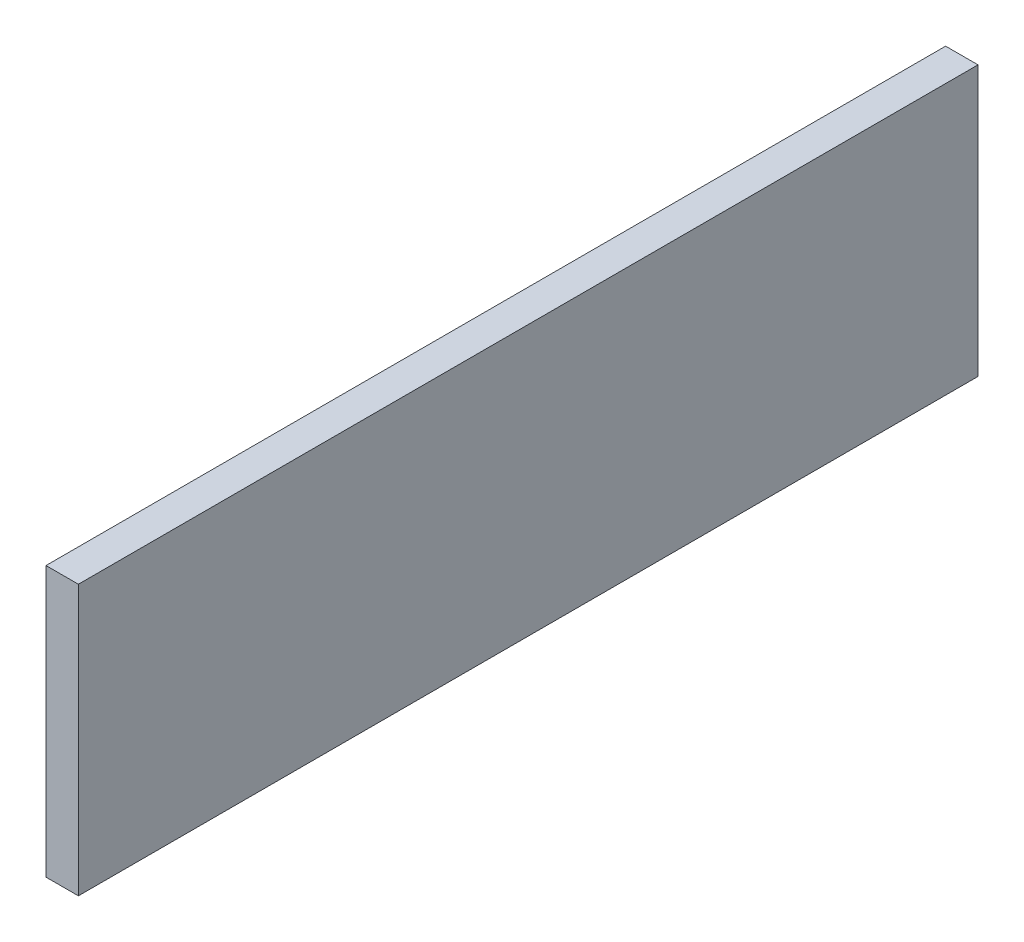
from build123d import *

# Parameters (mm, degrees)
SKETCH1_W           = 500
SKETCH1_H           = 150
BOSS_EXTRUDE1_DEPTH = 18


with BuildPart() as part:
    # Sketch1 → Boss-Extrude1 (new body)
    with BuildSketch(Plane(origin=(0, 0, 0), x_dir=(0, 0, -1), z_dir=(1, 0, 0))):
        with Locations((250, 75)):
            Rectangle(SKETCH1_W, SKETCH1_H)
    extrude(amount=BOSS_EXTRUDE1_DEPTH)


solid = part.part
